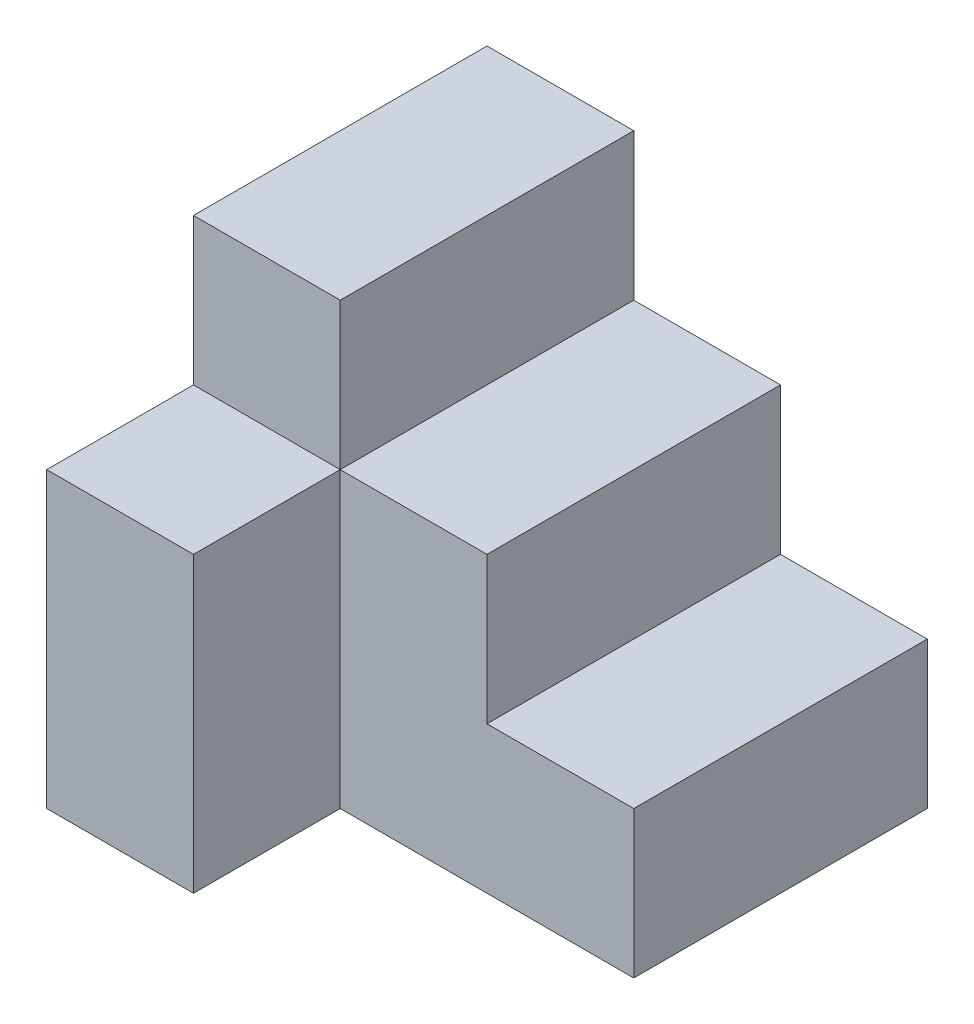
from build123d import *

# Parameters (mm, degrees)
SKETCH_1_W          = 30
SKETCH_1_H          = 30
EXTRUDE_1_DEPTH     = 30
CUT_EXTRUDE_1_DEPTH = 52.961524227
SKETCH_3_W          = 20
SKETCH_3_H          = 10
CUT_EXTRUDE_2_DEPTH = 52.961524227
SKETCH_4_W          = 10
SKETCH_4_H          = 10
CUT_EXTRUDE_3_DEPTH = 52.961524227


with BuildPart() as part:
    # 草圖1 → 填料-伸長1 (new body)
    with BuildSketch(Plane.XY):
        with Locations((15, 15)):
            Rectangle(SKETCH_1_W, SKETCH_1_H)
    extrude(amount=-EXTRUDE_1_DEPTH)

    # 草圖2 → 除料-伸長1 (cut, through all)
    with BuildSketch(Plane.XY):
        Polygon((30, 30), (10, 30), (10, 20), (20, 20), (20, 10), (30, 10), align=None)
    extrude(amount=-CUT_EXTRUDE_1_DEPTH, mode=Mode.SUBTRACT)

    # 草圖3 → 除料-伸長2 (cut, through all)
    with BuildSketch(Plane(origin=(0, 30, 0), x_dir=(1, 0, 0), z_dir=(0, 1, 0))):
        with Locations((20, 5)):
            Rectangle(SKETCH_3_W, SKETCH_3_H)
    extrude(amount=-CUT_EXTRUDE_2_DEPTH, mode=Mode.SUBTRACT)

    # 草圖4 → 除料-伸長3 (cut, through all)
    with BuildSketch(Plane(origin=(30, 0, 0), x_dir=(0, 0, -1), z_dir=(1, 0, 0))):
        with Locations((5, 25)):
            Rectangle(SKETCH_4_W, SKETCH_4_H)
    extrude(amount=-CUT_EXTRUDE_3_DEPTH, mode=Mode.SUBTRACT)


solid = part.part
